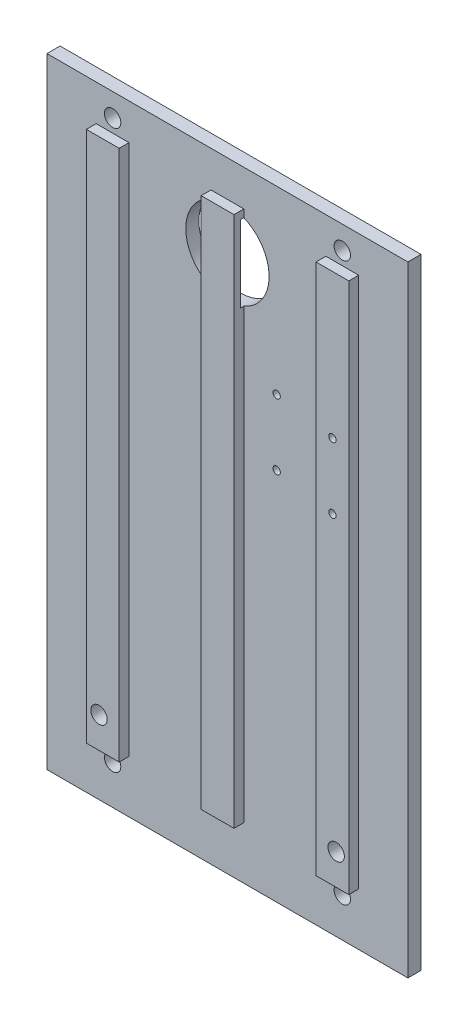
from build123d import *

# Parameters (mm, degrees)
SKETCH1_W               = 110
SKETCH1_H               = 189
BOSS_EXTRUDE1_DEPTH     = 4
SKETCH3_W               = 10
SKETCH3_H               = 162
BOSS_EXTRUDE2_DEPTH     = 3
CUT_EXTRUDE1_DEPTH      = 5
CUT_EXTRUDE1_DEPTH_BACK = 146
SKETCH2_R               = 2.5
SKETCH2_R_2             = 1.12
SKETCH4_R               = 12.7
CUT_EXTRUDE2_DEPTH      = 5


with BuildPart() as part:
    # Sketch1 → Boss-Extrude1 (new body)
    with BuildSketch(Plane.XY):
        with Locations((55, 94.5)):
            Rectangle(SKETCH1_W, SKETCH1_H)
    extrude(amount=BOSS_EXTRUDE1_DEPTH)

    # Sketch3 → Boss-Extrude2 (add)
    with BuildSketch(Plane.XY.offset(4)):
        with Locations((55, 97)):
            Rectangle(SKETCH3_W, SKETCH3_H)
        with Locations((20, 97)):
            Rectangle(SKETCH3_W, SKETCH3_H)
        with Locations((90, 97)):
            Rectangle(SKETCH3_W, SKETCH3_H)
    extrude(amount=BOSS_EXTRUDE2_DEPTH)

    # Sketch2 → Cut-Extrude1 (cut, two sides: drawn at the far end of the back side and taken through both)
    with BuildSketch(Plane.XY.offset(4).offset(-CUT_EXTRUDE1_DEPTH_BACK)):
        with Locations(Location((20, 12, 0), (0, 0, 180))):
            Circle(SKETCH2_R)
        with Locations(Location((90, 12, 0), (0, 0, 180))):
            Circle(SKETCH2_R)
        with Locations(Location((18.86, 25.4, 0), (0, 0, 180))):
            Circle(SKETCH2_R)
        with Locations(Location((91.14, 25.4, 0), (0, 0, 180))):
            Circle(SKETCH2_R)
        with Locations(Location((20, 182, 0), (0, 0, 180))):
            Circle(SKETCH2_R)
        with Locations(Location((90, 182, 0), (0, 0, 180))):
            Circle(SKETCH2_R)
        with Locations(Location((70, 134, 0), (0, 0, 180))):
            Circle(SKETCH2_R_2)
        with Locations(Location((90, 134, 0), (0, 0, 180))):
            Circle(SKETCH2_R_2)
        with Locations(Location((90, 114, 0), (0, 0, 180))):
            Circle(SKETCH2_R_2)
        with Locations(Location((70, 114, 0), (0, 0, 180))):
            Circle(SKETCH2_R_2)
    extrude(amount=CUT_EXTRUDE1_DEPTH + CUT_EXTRUDE1_DEPTH_BACK, mode=Mode.SUBTRACT)

    # Sketch4 → Cut-Extrude2 (cut)
    with BuildSketch(Plane(origin=(0, 0, 0), x_dir=(-1, 0, 0), z_dir=(0, 0, -1))):
        with Locations((-55, 164)):
            Circle(SKETCH4_R)
    extrude(amount=-CUT_EXTRUDE2_DEPTH, mode=Mode.SUBTRACT)


solid = part.part
